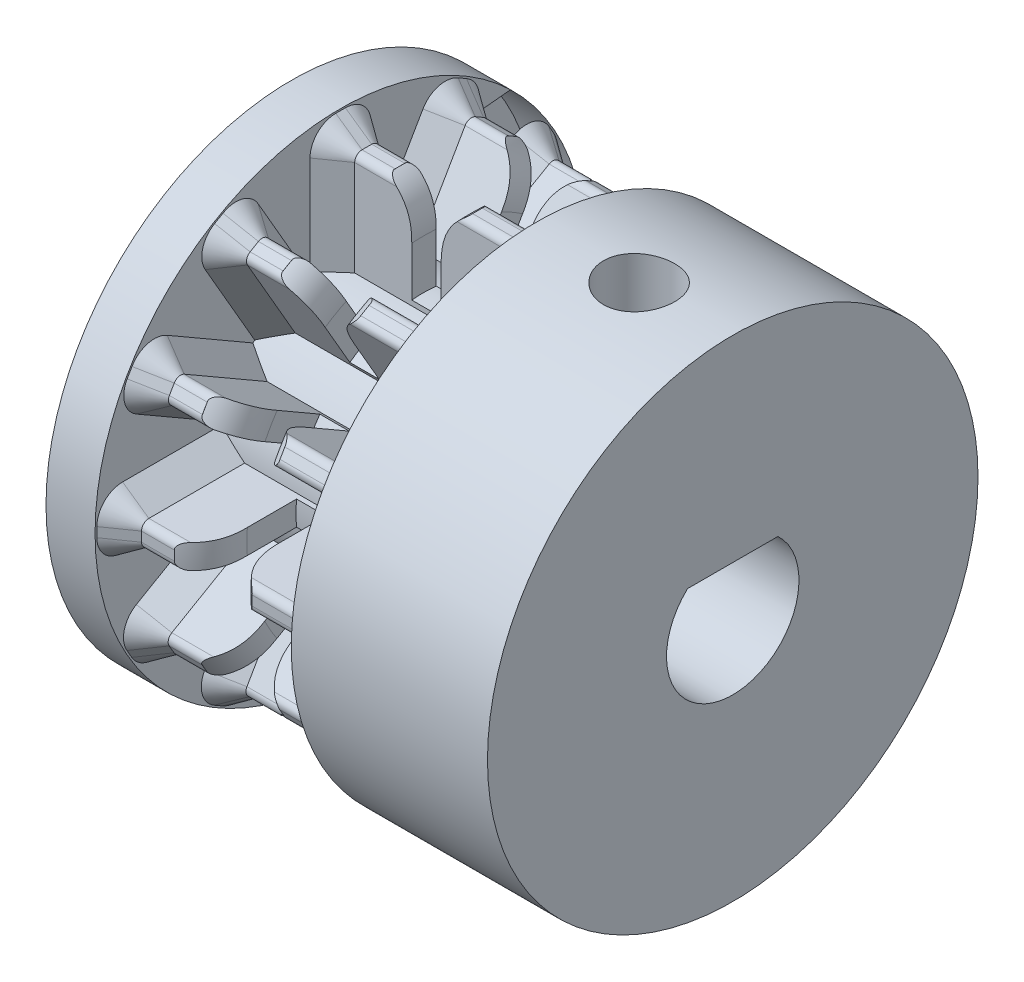
from build123d import *

# Parameters (mm, degrees)
SKETCH_1_R          = 10
EXTRUDE_1_DEPTH     = 2
EXTRUDE_2_DEPTH     = 8
SKETCH_3_R          = 10
EXTRUDE_3_DEPTH     = 8
CUT_EXTRUDE_1_DEPTH = 23.891046285
SKETCH_5_R          = 1.45
CUT_EXTRUDE_2_DEPTH = 9
CHAMFER_1_SIZE      = 0.75
CHAMFER_1_SIZE2     = 1.071111005


with BuildPart() as part:
    # Эскиз1 → Бобышка-Вытянуть1 (new body)
    with BuildSketch(Plane(origin=(0, 0, 0), x_dir=(0, 0, -1), z_dir=(1, 0, 0))):
        Circle(SKETCH_1_R)
    extrude(amount=EXTRUDE_1_DEPTH)

    # Эскиз2 → Бобышка-Вытянуть2 (add)
    with BuildSketch(Plane(origin=(2, 0, 0), x_dir=(0, 0, -1), z_dir=(1, 0, 0))):
        with BuildLine():
            Line((0.496383883, 4.974216517), (0, 4.974782748))
            Line((0, 4.974782748), (-0.485034292, 4.975336034))
            ThreePointArc((-0.485034292, 4.975336034), (-0.005702336, -4.998919323), (0.496383883, 4.974216517))
        make_face()
        with BuildLine():
            ThreePointArc((-0.485034292, 4.976418565), (-0.242803598, 4.994101162), (0, 5))
            ThreePointArc((0, 5), (0.253948164, 4.993546869), (0.507240824, 4.974204132))
            Line((0.507240824, 4.974204132), (0.507240824, 8.876165623))
            ThreePointArc((0.507240824, 8.876165623), (0.419372859, 9.088297657), (0.207240824, 9.176165623))
            Line((0.207240824, 9.176165623), (-0.185034292, 9.176165623))
            ThreePointArc((-0.185034292, 9.176165623), (-0.397166326, 9.088297657), (-0.485034292, 8.876165623))
            Line((-0.485034292, 8.876165623), (-0.485034292, 4.976418565))
        make_face()
        with BuildLine():
            ThreePointArc((-2.908261301, 4.067187751), (-2.490330373, 4.335695404), (-2.047818626, 4.561407554))
            Line((-2.047818626, 4.561407554), (-3.998799372, 7.94060533))
            ThreePointArc((-3.998799372, 7.94060533), (-4.180961279, 8.080383078), (-4.408606993, 8.050412951))
            Line((-4.408606993, 8.050412951), (-4.748327209, 7.854275393))
            ThreePointArc((-4.748327209, 7.854275393), (-4.888104957, 7.672113485), (-4.85813483, 7.444467771))
            Line((-4.85813483, 7.444467771), (-2.908261301, 4.067187751))
        make_face()
        with BuildLine():
            Line((4.018030793, 7.929502063), (2.068157264, 4.552222043))
            ThreePointArc((2.068157264, 4.552222043), (2.509657177, 4.324537068), (2.926385506, 4.05416673))
            Line((2.926385506, 4.05416673), (4.877366251, 7.433364505))
            ThreePointArc((4.877366251, 7.433364505), (4.907336378, 7.661010219), (4.76755863, 7.843172126))
            Line((4.76755863, 7.843172126), (4.427838414, 8.039309685))
            ThreePointArc((4.427838414, 8.039309685), (4.2001927, 8.069279811), (4.018030793, 7.929502063))
        make_face()
        with BuildLine():
            ThreePointArc((-4.552222043, 2.068157264), (-4.324537068, 2.509657177), (-4.05416673, 2.926385506))
            Line((-4.05416673, 2.926385506), (-7.433364505, 4.877366251))
            ThreePointArc((-7.433364505, 4.877366251), (-7.661010219, 4.907336378), (-7.843172126, 4.76755863))
            Line((-7.843172126, 4.76755863), (-8.039309685, 4.427838414))
            ThreePointArc((-8.039309685, 4.427838414), (-8.069279811, 4.2001927), (-7.929502063, 4.018030793))
            Line((-7.929502063, 4.018030793), (-4.552222043, 2.068157264))
        make_face()
        with BuildLine():
            Line((7.444467771, 4.85813483), (4.067187751, 2.908261301))
            ThreePointArc((4.067187751, 2.908261301), (4.335695404, 2.490330373), (4.561407554, 2.047818626))
            Line((4.561407554, 2.047818626), (7.94060533, 3.998799372))
            ThreePointArc((7.94060533, 3.998799372), (8.080383078, 4.180961279), (8.050412951, 4.408606993))
            Line((8.050412951, 4.408606993), (7.854275393, 4.748327209))
            ThreePointArc((7.854275393, 4.748327209), (7.672113485, 4.888104957), (7.444467771, 4.85813483))
        make_face()
        with BuildLine():
            ThreePointArc((-4.976418565, -0.485034292), (-4.999987549, 0.011158335), (-4.974204132, 0.507240824))
            Line((-4.974204132, 0.507240824), (-8.876165623, 0.507240824))
            ThreePointArc((-8.876165623, 0.507240824), (-9.088297657, 0.419372859), (-9.176165623, 0.207240824))
            Line((-9.176165623, 0.207240824), (-9.176165623, -0.185034292))
            ThreePointArc((-9.176165623, -0.185034292), (-9.088297657, -0.397166326), (-8.876165623, -0.485034292))
            Line((-8.876165623, -0.485034292), (-4.976418565, -0.485034292))
        make_face()
        with BuildLine():
            Line((8.876165623, 0.485034292), (4.976418565, 0.485034292))
            ThreePointArc((4.976418565, 0.485034292), (4.999987549, -0.011158335), (4.974204132, -0.507240824))
            Line((4.974204132, -0.507240824), (8.876165623, -0.507240824))
            ThreePointArc((8.876165623, -0.507240824), (9.088297657, -0.419372859), (9.176165623, -0.207240824))
            Line((9.176165623, -0.207240824), (9.176165623, 0.185034292))
            ThreePointArc((9.176165623, 0.185034292), (9.088297657, 0.397166326), (8.876165623, 0.485034292))
        make_face()
        with BuildLine():
            ThreePointArc((-4.067187751, -2.908261301), (-4.335695404, -2.490330373), (-4.561407554, -2.047818626))
            Line((-4.561407554, -2.047818626), (-7.94060533, -3.998799372))
            ThreePointArc((-7.94060533, -3.998799372), (-8.080383078, -4.180961279), (-8.050412951, -4.408606993))
            Line((-8.050412951, -4.408606993), (-7.854275393, -4.748327209))
            ThreePointArc((-7.854275393, -4.748327209), (-7.672113485, -4.888104957), (-7.444467771, -4.85813483))
            Line((-7.444467771, -4.85813483), (-4.067187751, -2.908261301))
        make_face()
        with BuildLine():
            ThreePointArc((-2.068157264, -4.552222043), (-2.509657177, -4.324537068), (-2.926385506, -4.05416673))
            Line((-2.926385506, -4.05416673), (-4.877366251, -7.433364505))
            ThreePointArc((-4.877366251, -7.433364505), (-4.907336378, -7.661010219), (-4.76755863, -7.843172126))
            Line((-4.76755863, -7.843172126), (-4.427838414, -8.039309685))
            ThreePointArc((-4.427838414, -8.039309685), (-4.2001927, -8.069279811), (-4.018030793, -7.929502063))
            Line((-4.018030793, -7.929502063), (-2.068157264, -4.552222043))
        make_face()
        with BuildLine():
            Line((7.929502063, -4.018030793), (4.552222043, -2.068157264))
            ThreePointArc((4.552222043, -2.068157264), (4.324537068, -2.509657177), (4.05416673, -2.926385506))
            Line((4.05416673, -2.926385506), (7.433364505, -4.877366251))
            ThreePointArc((7.433364505, -4.877366251), (7.661010219, -4.907336378), (7.843172126, -4.76755863))
            Line((7.843172126, -4.76755863), (8.039309685, -4.427838414))
            ThreePointArc((8.039309685, -4.427838414), (8.069279811, -4.2001927), (7.929502063, -4.018030793))
        make_face()
        with BuildLine():
            ThreePointArc((0.485034292, -4.976418565), (-0.011158335, -4.999987549), (-0.507240824, -4.974204132))
            Line((-0.507240824, -4.974204132), (-0.507240824, -8.876165623))
            ThreePointArc((-0.507240824, -8.876165623), (-0.419372859, -9.088297657), (-0.207240824, -9.176165623))
            Line((-0.207240824, -9.176165623), (0.185034292, -9.176165623))
            ThreePointArc((0.185034292, -9.176165623), (0.397166326, -9.088297657), (0.485034292, -8.876165623))
            Line((0.485034292, -8.876165623), (0.485034292, -4.976418565))
        make_face()
        with BuildLine():
            Line((4.85813483, -7.444467771), (2.908261301, -4.067187751))
            ThreePointArc((2.908261301, -4.067187751), (2.490330373, -4.335695404), (2.047818626, -4.561407554))
            Line((2.047818626, -4.561407554), (3.998799372, -7.94060533))
            ThreePointArc((3.998799372, -7.94060533), (4.180961279, -8.080383078), (4.408606993, -8.050412951))
            Line((4.408606993, -8.050412951), (4.748327209, -7.854275393))
            ThreePointArc((4.748327209, -7.854275393), (4.888104957, -7.672113485), (4.85813483, -7.444467771))
        make_face()
    extrude(amount=EXTRUDE_2_DEPTH)

    # Эскиз3 → Бобышка-Вытянуть3 (add)
    with BuildSketch(Plane(origin=(10, 0, 0), x_dir=(0, 0, -1), z_dir=(1, 0, 0))):
        Circle(SKETCH_3_R)
    extrude(amount=EXTRUDE_3_DEPTH)

    # Эскиз4 → Вырез-Вытянуть1 (cut, through all)
    with BuildSketch(Plane(origin=(18, 0, 0), x_dir=(0, 0, -1), z_dir=(1, 0, 0))):
        with BuildLine():
            Line((1.843086394, 1.973076923), (-0.068262459, 1.973076923))
            Line((-0.068262459, 1.973076923), (-1.843086394, 1.973076923))
            ThreePointArc((-1.843086394, 1.973076923), (0, -2.7), (1.843086394, 1.973076923))
        make_face()
    extrude(amount=-CUT_EXTRUDE_1_DEPTH, mode=Mode.SUBTRACT)

    # Эскиз5 → Вырез-Вытянуть2 (cut)
    with BuildSketch(Plane(origin=(0, 1.973076923, 0), x_dir=(-1, 0, 0), z_dir=(0, -1, 0))):
        with Locations(Location((-14.183066726, 0, 0), (0, 0, 90))):
            Circle(SKETCH_5_R)
    extrude(amount=-CUT_EXTRUDE_2_DEPTH, mode=Mode.SUBTRACT)

    # Эскиз7 → Вырез-Повернуть5 (revolve, cut)
    with BuildSketch(Plane(origin=(0, 0, 0), x_dir=(1, 0, 0), z_dir=(0, 1, 0))):
        with BuildLine():
            Line((6.597476563, -5.20607088), (5.398528758, -5.20607088))
            Line((5.398528758, -5.20607088), (5.398528758, -7.207129397))
            add(Edge.make_bspline(
                [(5.398528758, -7.207129397), (5.435825071, -8.522828963), (4.415682514, -9.174569024)],
                knots=[0, 0, 0, 1, 1, 1], degree=2))
            Line((4.415682514, -9.174569024), (4.415682514, -9.495556422))
            Line((4.415682514, -9.495556422), (7.580322806, -9.495556422))
            Line((7.580322806, -9.495556422), (7.580322806, -9.174569024))
            add(Edge.make_bspline(
                [(6.597476563, -7.207129397), (6.616939399, -8.483395972), (7.580322806, -9.174569024)],
                knots=[0, 0, 0, 1, 1, 1], degree=2))
            Line((6.597476563, -7.207129397), (6.597476563, -5.20607088))
        make_face()
    revolve(axis=Axis((0, 0, 0), (1, 0, 0)), mode=Mode.SUBTRACT)

    # Фаска1
    chamfer_1_edges = [part.edges().sort_by_distance(p)[0] for p in [
        (2, 7.941240905, -4.597698522),
        (2, 8.069279811, -4.2001927),
        (2, 6.240862053, -3.043094028),
        (2, 6.251006442, 3.023308999),
        (2, 5.743765617, -3.901875878),
        (2, 7.661010219, -4.907336378),
        (2, 4.578467101, -7.952344172),
        (2, 4.888104957, -7.672113485),
        (2, 3.883198066, -5.755827761),
        (2, 8.080383078, 4.180961279),
        (2, 3.023308999, -6.251006442),
        (2, 4.180961279, -8.080383078),
        (2, -0.011103266, -9.176165623),
        (2, 0.397166326, -9.088297657),
        (2, 0.485034292, -6.926292094),
        (2, -0.507240824, -6.925184877),
        (2, -0.419372859, -9.088297657),
        (2, -4.597698522, -7.941240905),
        (2, -4.2001927, -8.069279811),
        (2, -3.043094028, -6.240862053),
        (2, -3.901875878, -5.743765617),
        (2, -4.907336378, -7.661010219),
        (2, -7.952344172, -4.578467101),
        (2, -7.672113485, -4.888104957),
        (2, -5.755827761, -3.883198066),
        (2, -6.251006442, -3.023308999),
        (2, -8.080383078, -4.180961279),
        (2, -9.176165623, 0.011103266),
        (2, -9.088297657, -0.397166326),
        (2, -6.926292094, -0.485034292),
        (2, -6.925184877, 0.507240824),
        (2, -9.088297657, 0.419372859),
        (2, 4.597698522, 7.941240905),
        (2, 4.2001927, 8.069279811),
        (2, 3.043094028, 6.240862053),
        (2, 3.901875878, 5.743765617),
        (2, 4.907336378, 7.661010219),
        (2, 0.011103266, 9.176165623),
        (2, -0.397166326, 9.088297657),
        (2, -0.485034292, 6.926292094),
        (2, 0.507240824, 6.925184877),
        (2, 0.419372859, 9.088297657),
        (2, -4.578467101, 7.952344172),
        (2, -4.888104957, 7.672113485),
        (2, -3.883198066, 5.755827761),
        (2, -3.023308999, 6.251006442),
        (2, -4.180961279, 8.080383078),
        (2, -7.941240905, 4.597698522),
        (2, -8.069279811, 4.2001927),
        (2, -6.240862053, 3.043094028),
        (2, -5.743765617, 3.901875878),
        (2, -7.661010219, 4.907336378),
        (2, 9.176165623, -0.011103266),
        (2, 9.088297657, 0.397166326),
        (2, 7.952344172, 4.578467101),
        (2, 6.926292094, 0.485034292),
        (2, 6.925184877, -0.507240824),
        (2, 9.088297657, -0.419372859),
        (2, 7.672113485, 4.888104957),
        (2, 5.755827761, 3.883198066),
    ]]
    chamfer_1_side = [part.faces().sort_by_distance(p)[0] for p in [
        (2, 0, 9.717157288),
    ]]
    chamfer(chamfer_1_edges, length=CHAMFER_1_SIZE, length2=CHAMFER_1_SIZE2, reference=chamfer_1_side[0])


solid = part.part
